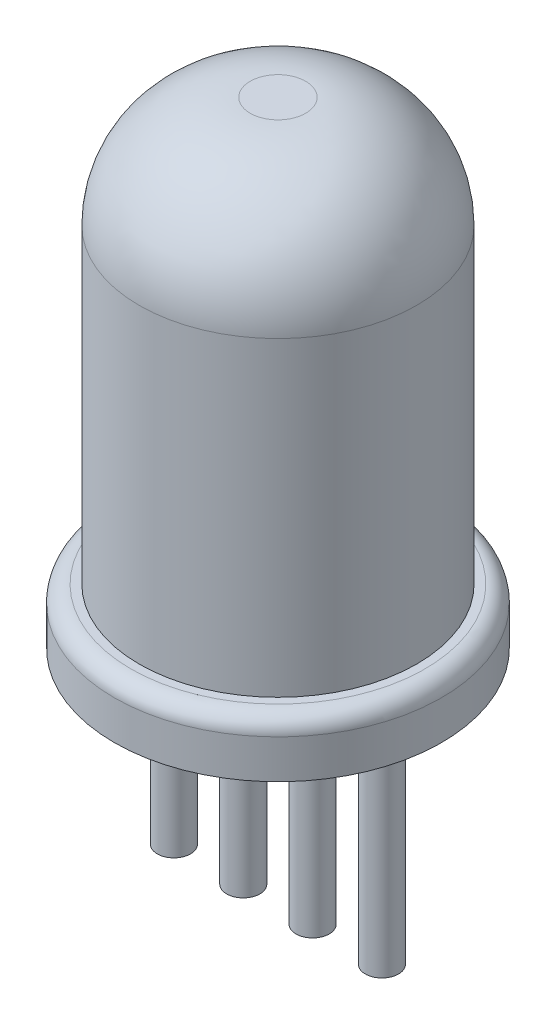
from build123d import *

# Parameters (mm, degrees)
EXTRUDE_START          = 4
SKETCH_1_R             = 2.95
EXTRUDE_1_DEPTH        = 1
SKETCH_3_R             = 2.5
EXTRUDE_2_DEPTH        = 7.6
FILLET_1_R             = 2
FILLET_2_R             = 0.3
SWEEP_1_PROFILE_R      = 0.3
PATTERN_LINEAR_1_COUNT = 4
PATTERN_LINEAR_1_PITCH = 1.25


with BuildPart() as part:
    # Эскиз1 → Бобышка-Вытянуть1 (new body)
    with BuildSketch(Plane(origin=(0, 0, 0), x_dir=(1, 0, 0), z_dir=(0, 1, 0)).offset(EXTRUDE_START)):
        with Locations(Location((0, 0, 0), (0, 0, 270))):
            Circle(SKETCH_1_R)
    extrude(amount=EXTRUDE_1_DEPTH)

    # Эскиз3 → Бобышка-Вытянуть2 (add)
    with BuildSketch(Plane(origin=(0, 5, 0), x_dir=(1, 0, 0), z_dir=(0, 1, 0))):
        with Locations(Location((0, 0, 0), (0, 0, 90))):
            Circle(SKETCH_3_R)
    extrude(amount=EXTRUDE_2_DEPTH)

    # Скругление1
    fillet_1_edges = [part.edges().sort_by_distance(p)[0] for p in [
        (0, 12.6, 2.5),
    ]]
    fillet(fillet_1_edges, radius=FILLET_1_R)

    # Скругление2
    fillet_2_edges = [part.edges().sort_by_distance(p)[0] for p in [
        (0, 5, -2.95),
    ]]
    fillet(fillet_2_edges, radius=FILLET_2_R)


with BuildPart() as body_2:
    # По траектории1: sweep along a path in Эскиз6
    with BuildLine(Plane.XY) as sweep_1_path:
        Line((-1.875, 4), (-1.875, 0))
    # По траектории1 profile (on start of the path) → По траектории1 (sweep)
    with BuildSketch(Plane(origin=(-1.875, 4, 0), x_dir=(-1, 0, 0), z_dir=(0, -1, 0))):
        Circle(SWEEP_1_PROFILE_R)
    sweep_1 = sweep(path=sweep_1_path.line)


with BuildPart() as pattern_linear_1_1:
    # Линейный массив1: По траектории1 ×4
    with Locations(*[(i * PATTERN_LINEAR_1_PITCH, 0, 0) for i in range(1, PATTERN_LINEAR_1_COUNT)]):
        add(sweep_1)


solid = Compound([part.part, body_2.part, pattern_linear_1_1.part])
